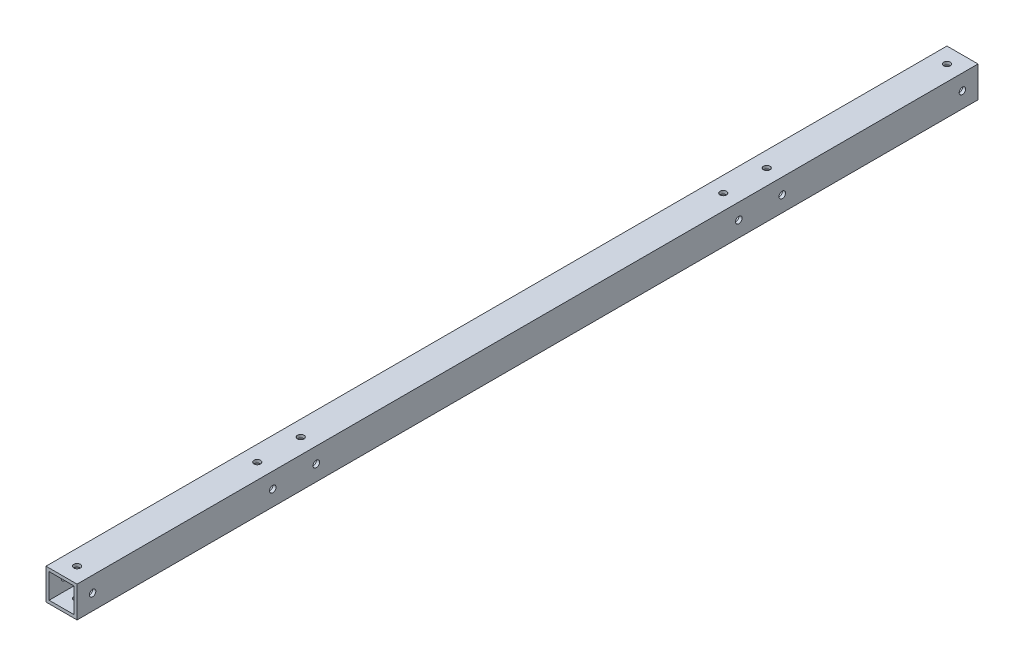
from build123d import *

# Parameters (mm, degrees)
SKETCH_1_W          = 20
SKETCH_1_H          = 20
SKETCH_1_W_2        = 16
SKETCH_1_H_2        = 16
EXTRUDE_1_DEPTH     = 580
SKETCH_2_R          = 2.1
CUT_EXTRUDE_1_DEPTH = 20
SKETCH_3_R          = 2.1
CUT_EXTRUDE_2_DEPTH = 581.430874437


with BuildPart() as part:
    # 草图1 → 凸台-拉伸1 (new body)
    with BuildSketch(Plane.XY):
        Rectangle(SKETCH_1_W, SKETCH_1_H)
        Rectangle(SKETCH_1_W_2, SKETCH_1_H_2, mode=Mode.SUBTRACT)
    extrude(amount=EXTRUDE_1_DEPTH)

    # 草图2 → 切除-拉伸1 (cut)
    with BuildSketch(Plane(origin=(0, 10, 0), x_dir=(1, 0, 0), z_dir=(0, 1, 0))):
        with Locations(Location((0, -10, 0), (0, 0, 270))):
            Circle(SKETCH_2_R)
        with Locations(Location((0, -126, 0), (0, 0, 270))):
            Circle(SKETCH_2_R)
        with Locations(Location((0, -154, 0), (0, 0, 270))):
            Circle(SKETCH_2_R)
    cut_extrude_1 = extrude(amount=-CUT_EXTRUDE_1_DEPTH, mode=Mode.SUBTRACT)

    # 镜向1: 切除-拉伸1 across plane
    add(cut_extrude_1.mirror(Plane.XY.offset(290)), mode=Mode.SUBTRACT)

    # 草图3 → 切除-拉伸2 (cut, through all)
    with BuildSketch(Plane(origin=(10, 0, 0), x_dir=(0, 0, -1), z_dir=(1, 0, 0))):
        with Locations((-570, 0)):
            Circle(SKETCH_3_R)
        with Locations((-10, 0)):
            Circle(SKETCH_3_R)
        with Locations((-454, 0)):
            Circle(SKETCH_3_R)
        with Locations((-426, 0)):
            Circle(SKETCH_3_R)
        with Locations(Location((-126, 0, 0), (0, 0, 180))):
            Circle(SKETCH_3_R)
        with Locations(Location((-154, 0, 0), (0, 0, 180))):
            Circle(SKETCH_3_R)
    extrude(amount=-CUT_EXTRUDE_2_DEPTH, mode=Mode.SUBTRACT)


solid = part.part
